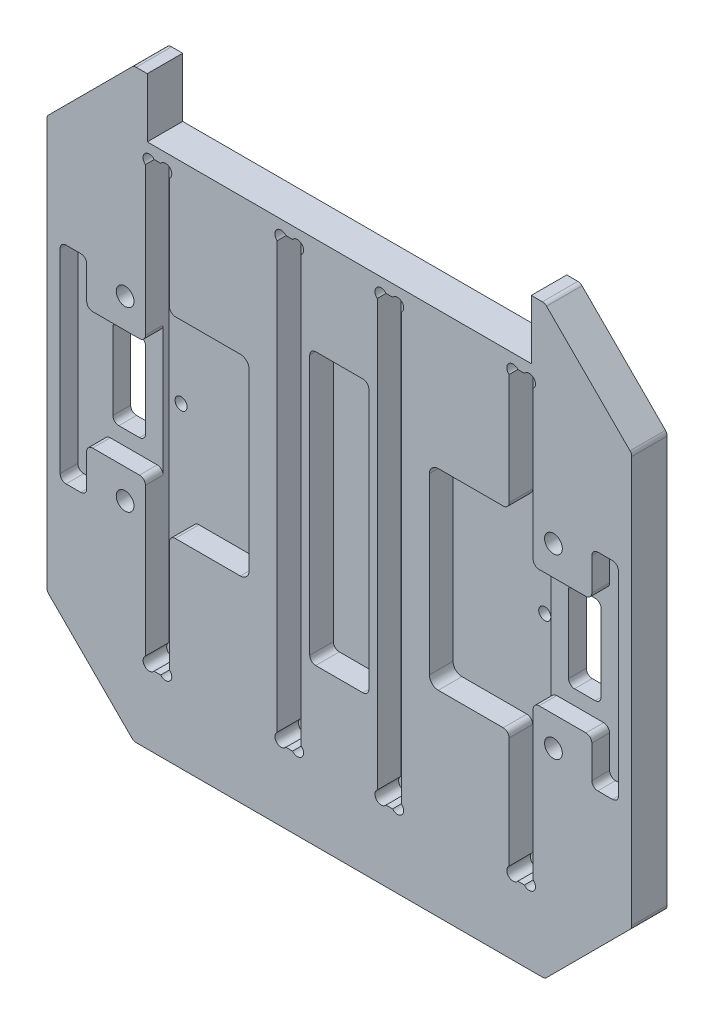
from build123d import *

# Parameters (mm, degrees)
ESQUISSE2_W                   = 200
ESQUISSE2_H                   = 200
BOSS_EXTRU_1_DEPTH            = 12
CHANFREIN1_SIZE               = 30
ENL_V_MAT_EXTRU_1_DEPTH       = 284.097156468
ENL_V_MAT_EXTRU_1_DEPTH_BACK  = 284.097156468
ESQUISSE3_R                   = 3
ENL_V_MAT_EXTRU_2_DEPTH       = 10
ESQUISSE5_W                   = 20
ESQUISSE5_H                   = 40
ENL_V_MAT_EXTRU_3_DEPTH       = 6
ESQUISSE6_W                   = 8.12
ESQUISSE6_H                   = 150
ENL_V_MAT_EXTRU_4_DEPTH       = 8
ESQUISSE7_R                   = 2.1
ENL_V_MAT_EXTRU_5_DEPTH       = 8
ESQUISSE8_W                   = 20
ESQUISSE8_H                   = 92
ENL_V_MAT_EXTRU_6_DEPTH       = 8
ENL_V_START                   = -8
ENL_V_MAT_EXTRU_8_DEPTH       = 8
ENL_V_MAT_EXTRU_9_DEPTH       = 283.906344927
ENL_V_MAT_EXTRU_9_DEPTH_BACK  = 283.906344927
ESQUISSE11_W                  = 11
ESQUISSE11_H                  = 30
CONG_1_R                      = 2
CONG_2_R                      = 2
ENL_V_MAT_EXTRU_7_DEPTH       = 284.097156468
ENL_V_MAT_EXTRU_7_DEPTH_BACK  = 284.097156468
CONG_3_R                      = 2
BOSS_EXTRU_2_DEPTH            = 4
BOSS_EXTRU_3_DEPTH            = 6
ENL_V_MAT_EXTRU_10_DEPTH      = 282.542181564
ENL_V_MAT_EXTRU_10_DEPTH_BACK = 282.542181564
ESQUISSE14_R                  = 2.05
ENL_V_MAT_EXTRU_11_DEPTH      = 282.68422036
ENL_V_MAT_EXTRU_11_DEPTH_BACK = 282.68422036
ESQUISSE15_W                  = 130
ESQUISSE15_H                  = 20


with BuildPart() as part:
    # Esquisse2 → Boss.-Extru.1 (new body)
    with BuildSketch(Plane.XY):
        with Locations((100, 100)):
            Rectangle(ESQUISSE2_W, ESQUISSE2_H)
    extrude(amount=BOSS_EXTRU_1_DEPTH)

    # Chanfrein1
    chanfrein1_edges = [part.edges().sort_by_distance(p)[0] for p in [
        (0, 200, 6),
        (200, 200, 6),
        (200, 0, 6),
        (0, 0, 6),
    ]]
    chamfer(chanfrein1_edges, length=CHANFREIN1_SIZE)

    # Esquisse3 → Enlèv. mat.-Extru.1 (cut, two sides: drawn at the far end of the back side and taken through both)
    with BuildSketch(Plane.XY.offset(12).offset(-ENL_V_MAT_EXTRU_1_DEPTH_BACK)):
        with Locations((172.5, 130)):
            Circle(ESQUISSE3_R)
        with Locations(Location((172.5, 70, 0), (0, 0, 180))):
            Circle(ESQUISSE3_R)
        with Locations((27.5, 70)):
            Circle(ESQUISSE3_R)
        with Locations(Location((27.5, 130, 0), (0, 0, 180))):
            Circle(ESQUISSE3_R)
        with BuildLine():
            Line((185.5, 67), (185.5, 133))
            ThreePointArc((185.5, 133), (186.085786438, 134.414213562), (187.5, 135))
            Line((187.5, 135), (192.5, 135))
            ThreePointArc((192.5, 135), (193.914213562, 134.414213562), (194.5, 133))
            Line((194.5, 133), (194.5, 67))
            ThreePointArc((194.5, 67), (193.914213562, 65.585786438), (192.5, 65))
            Line((192.5, 65), (187.5, 65))
            ThreePointArc((187.5, 65), (186.085786438, 65.585786438), (185.5, 67))
        make_face()
        with BuildLine():
            Line((12.5, 65), (7.5, 65))
            ThreePointArc((7.5, 65), (6.085786438, 65.585786438), (5.5, 67))
            Line((5.5, 67), (5.5, 133))
            ThreePointArc((5.5, 133), (6.085786438, 134.414213562), (7.5, 135))
            Line((7.5, 135), (12.5, 135))
            ThreePointArc((12.5, 135), (13.914213562, 134.414213562), (14.5, 133))
            Line((14.5, 133), (14.5, 67))
            ThreePointArc((14.5, 67), (13.914213562, 65.585786438), (12.5, 65))
        make_face()
        with BuildLine():
            Line((69.5, 70.5), (69.5, 129.5))
            ThreePointArc((69.5, 129.5), (68.621320344, 131.621320344), (66.5, 132.5))
            Line((66.5, 132.5), (45.5, 132.5))
            ThreePointArc((45.5, 132.5), (43.378679656, 131.621320344), (42.5, 129.5))
            Line((42.5, 129.5), (42.5, 70.5))
            ThreePointArc((42.5, 70.5), (43.378679656, 68.378679656), (45.5, 67.5))
            Line((45.5, 67.5), (66.5, 67.5))
            ThreePointArc((66.5, 67.5), (68.621320344, 68.378679656), (69.5, 70.5))
        make_face()
        with BuildLine():
            Line((133.5, 67.5), (154.5, 67.5))
            ThreePointArc((154.5, 67.5), (156.621320344, 68.378679656), (157.5, 70.5))
            Line((157.5, 70.5), (157.5, 129.5))
            ThreePointArc((157.5, 129.5), (156.621320344, 131.621320344), (154.5, 132.5))
            Line((154.5, 132.5), (133.5, 132.5))
            ThreePointArc((133.5, 132.5), (131.378679656, 131.621320344), (130.5, 129.5))
            Line((130.5, 129.5), (130.5, 70.5))
            ThreePointArc((130.5, 70.5), (131.378679656, 68.378679656), (133.5, 67.5))
        make_face()
    extrude(amount=ENL_V_MAT_EXTRU_1_DEPTH + ENL_V_MAT_EXTRU_1_DEPTH_BACK, mode=Mode.SUBTRACT)

    # Esquisse4 → Enlèv. mat.-Extru.2 (cut)
    with BuildSketch(Plane.XY.offset(12)):
        Polygon((170, 200), (30, 200), (0, 170), (0, 30), (30, 0), (170, 0), (200, 30), (200, 170), align=None)
        Polygon((169.585786438, 199), (30.414213562, 199), (1, 169.585786438), (1, 30.414213562), (30.414213562, 1), (169.585786438, 1), (199, 30.414213562), (199, 169.585786438), align=None, mode=Mode.SUBTRACT)
    extrude(amount=-ENL_V_MAT_EXTRU_2_DEPTH, mode=Mode.SUBTRACT)

    # Esquisse5 → Enlèv. mat.-Extru.3 (cut)
    with BuildSketch(Plane.XY.offset(12)):
        with Locations((24.5, 100)):
            Rectangle(ESQUISSE5_W, ESQUISSE5_H)
        with Locations((175.5, 100)):
            Rectangle(ESQUISSE5_W, ESQUISSE5_H)
    extrude(amount=-ENL_V_MAT_EXTRU_3_DEPTH, mode=Mode.SUBTRACT)

    # Esquisse6 → Enlèv. mat.-Extru.4 (cut)
    with BuildSketch(Plane.XY.offset(12)):
        with Locations((161.56, 100)):
            Rectangle(ESQUISSE6_W, ESQUISSE6_H)
        with Locations((38.44, 100)):
            Rectangle(ESQUISSE6_W, ESQUISSE6_H)
        with Locations((116.94, 100)):
            Rectangle(ESQUISSE6_W, ESQUISSE6_H)
        with Locations((83.06, 100)):
            Rectangle(ESQUISSE6_W, ESQUISSE6_H)
    extrude(amount=-ENL_V_MAT_EXTRU_4_DEPTH, mode=Mode.SUBTRACT)

    # Esquisse7 → Enlèv. mat.-Extru.5 (cut)
    with BuildSketch(Plane.XY.offset(12)):
        with Locations((114.18, 173.7)):
            Circle(ESQUISSE7_R)
        with Locations((119.7, 173.7)):
            Circle(ESQUISSE7_R)
        with Locations((119.7, 26.3)):
            Circle(ESQUISSE7_R)
        with Locations((114.18, 26.3)):
            Circle(ESQUISSE7_R)
        with Locations((164.32, 26.3)):
            Circle(ESQUISSE7_R)
        with Locations((158.8, 26.3)):
            Circle(ESQUISSE7_R)
        with Locations((158.8, 173.7)):
            Circle(ESQUISSE7_R)
        with Locations((164.32, 173.7)):
            Circle(ESQUISSE7_R)
        with Locations((35.68, 173.7)):
            Circle(ESQUISSE7_R)
        with Locations((41.2, 173.7)):
            Circle(ESQUISSE7_R)
        with Locations((41.2, 26.3)):
            Circle(ESQUISSE7_R)
        with Locations((35.68, 26.3)):
            Circle(ESQUISSE7_R)
        with Locations((85.82, 26.3)):
            Circle(ESQUISSE7_R)
        with Locations((80.3, 26.3)):
            Circle(ESQUISSE7_R)
        with Locations((80.3, 173.7)):
            Circle(ESQUISSE7_R)
        with Locations((85.82, 173.7)):
            Circle(ESQUISSE7_R)
    extrude(amount=-ENL_V_MAT_EXTRU_5_DEPTH, mode=Mode.SUBTRACT)

    # Esquisse8 → Enlèv. mat.-Extru.6 (cut)
    with BuildSketch(Plane.XY.offset(12)):
        with Locations((100, 100)):
            Rectangle(ESQUISSE8_W, ESQUISSE8_H)
    extrude(amount=-ENL_V_MAT_EXTRU_6_DEPTH, mode=Mode.SUBTRACT)

    # Esquisse10 → Enlèv. mat.-Extru.8 (cut)
    with BuildSketch(Plane.XY.offset(12).offset(ENL_V_START)):
        Polygon((45.5, 132.5), (42.5, 132.5), (42.5, 129.5), align=None)
        Polygon((42.5, 70.5), (45.5, 67.5), (42.5, 67.5), align=None)
        Polygon((154.5, 67.5), (157.5, 67.5), (157.5, 70.5), align=None)
        Polygon((157.5, 129.5), (154.5, 132.5), (157.5, 132.5), align=None)
    extrude(amount=ENL_V_MAT_EXTRU_8_DEPTH, mode=Mode.SUBTRACT)

    # Esquisse11 → Enlèv. mat.-Extru.9 (cut, two sides: drawn at the far end of the back side and taken through both)
    with BuildSketch(Plane.XY.offset(6).offset(-ENL_V_MAT_EXTRU_9_DEPTH_BACK)):
        with Locations((22.88, 100)):
            Rectangle(ESQUISSE11_W, ESQUISSE11_H)
        with Locations((177.12, 100)):
            Rectangle(ESQUISSE11_W, ESQUISSE11_H)
    extrude(amount=ENL_V_MAT_EXTRU_9_DEPTH + ENL_V_MAT_EXTRU_9_DEPTH_BACK, mode=Mode.SUBTRACT)

    # Congé1
    cong_1_edges = [part.edges().sort_by_distance(p)[0] for p in [
        (185.5, 120, 9),
        (185.5, 80, 9),
        (14.5, 120, 9),
        (14.5, 80, 9),
        (165.62, 120, 9),
        (165.62, 80, 9),
        (34.38, 120, 9),
        (34.38, 80, 9),
        (90, 146, 8),
        (110, 146, 8),
        (110, 54, 8),
        (90, 54, 8),
        (42.5, 132.5, 8),
        (42.5, 67.5, 8),
        (157.5, 67.5, 8),
        (157.5, 132.5, 8),
    ]]
    fillet(cong_1_edges, radius=CONG_1_R)

    # Congé2
    cong_2_edges = [part.edges().sort_by_distance(p)[0] for p in [
        (0, 30, 1),
        (30, 200, 1),
        (30, 0, 1),
        (200, 30, 1),
        (170, 200, 1),
        (0, 170, 1),
        (199, 169.585786438, 7),
        (199, 30.414213562, 7),
        (169.585786438, 1, 7),
        (30.414213562, 1, 7),
        (1, 30.414213562, 7),
        (1, 169.585786438, 7),
        (30.414213562, 199, 7),
        (169.585786438, 199, 7),
        (200, 170, 1),
        (170, 0, 1),
    ]]
    fillet(cong_2_edges, radius=CONG_2_R)

    # Esquisse9 → Enlèv. mat.-Extru.7 (cut, two sides: drawn at the far end of the back side and taken through both)
    with BuildSketch(Plane.XY.offset(12).offset(-ENL_V_MAT_EXTRU_7_DEPTH_BACK)):
        with BuildLine():
            Line((22.757359313, 205.485281374), (-5.485281374, 177.242640687))
            ThreePointArc((-5.485281374, 177.242640687), (-8.08655439, 173.349560501), (-9, 168.757359313))
            Line((-9, 168.757359313), (-9, 31.242640687))
            ThreePointArc((-9, 31.242640687), (-8.08655439, 26.650439499), (-5.485281374, 22.757359313))
            Line((-5.485281374, 22.757359313), (22.757359313, -5.485281374))
            ThreePointArc((22.757359313, -5.485281374), (26.650439499, -8.08655439), (31.242640687, -9))
            Line((31.242640687, -9), (168.757359313, -9))
            ThreePointArc((168.757359313, -9), (173.349560501, -8.08655439), (177.242640687, -5.485281374))
            Line((177.242640687, -5.485281374), (205.485281374, 22.757359313))
            ThreePointArc((205.485281374, 22.757359313), (208.08655439, 26.650439499), (209, 31.242640687))
            Line((209, 31.242640687), (209, 168.757359313))
            ThreePointArc((209, 168.757359313), (208.08655439, 173.349560501), (205.485281374, 177.242640687))
            Line((205.485281374, 177.242640687), (177.242640687, 205.485281374))
            ThreePointArc((177.242640687, 205.485281374), (173.349560501, 208.08655439), (168.757359313, 209))
            Line((168.757359313, 209), (31.242640687, 209))
            ThreePointArc((31.242640687, 209), (26.650439499, 208.08655439), (22.757359313, 205.485281374))
        make_face()
        with BuildLine():
            Line((29.828427125, 198.414213562), (1.585786438, 170.171572875))
            ThreePointArc((1.585786438, 170.171572875), (1.152240935, 169.522726178), (1, 168.757359313))
            Line((1, 168.757359313), (1, 31.242640687))
            ThreePointArc((1, 31.242640687), (1.152240935, 30.477273822), (1.585786438, 29.828427125))
            Line((1.585786438, 29.828427125), (29.828427125, 1.585786438))
            ThreePointArc((29.828427125, 1.585786438), (30.477273822, 1.152240935), (31.242640687, 1))
            Line((31.242640687, 1), (168.757359313, 1))
            ThreePointArc((168.757359313, 1), (169.522726178, 1.152240935), (170.171572875, 1.585786438))
            Line((170.171572875, 1.585786438), (198.414213562, 29.828427125))
            ThreePointArc((198.414213562, 29.828427125), (198.847759065, 30.477273822), (199, 31.242640687))
            Line((199, 31.242640687), (199, 168.757359313))
            ThreePointArc((199, 168.757359313), (198.847759065, 169.522726178), (198.414213562, 170.171572875))
            Line((198.414213562, 170.171572875), (170.171572875, 198.414213562))
            ThreePointArc((170.171572875, 198.414213562), (169.522726178, 198.847759065), (168.757359313, 199))
            Line((168.757359313, 199), (31.242640687, 199))
            ThreePointArc((31.242640687, 199), (30.477273822, 198.847759065), (29.828427125, 198.414213562))
        make_face(mode=Mode.SUBTRACT)
    extrude(amount=ENL_V_MAT_EXTRU_7_DEPTH + ENL_V_MAT_EXTRU_7_DEPTH_BACK, mode=Mode.SUBTRACT)

    # Congé3
    cong_3_edges = [part.edges().sort_by_distance(p)[0] for p in [
        (17.38, 85, 3),
        (17.38, 115, 3),
        (28.38, 115, 3),
        (28.38, 85, 3),
        (171.62, 115, 3),
        (182.62, 115, 3),
        (182.62, 85, 3),
        (171.62, 85, 3),
    ]]
    fillet(cong_3_edges, radius=CONG_3_R)

    # Esquisse12 → Boss.-Extru.2 (add)
    with BuildSketch(Plane(origin=(0, 0, 0), x_dir=(-1, 0, 0), z_dir=(0, 0, -1))):
        with BuildLine():
            Line((-69.5, 70.5), (-69.5, 129.5))
            ThreePointArc((-69.5, 129.5), (-68.621320344, 131.621320344), (-66.5, 132.5))
            Line((-66.5, 132.5), (-45.5, 132.5))
            ThreePointArc((-45.5, 132.5), (-43.378679656, 131.621320344), (-42.5, 129.5))
            Line((-42.5, 129.5), (-42.5, 70.5))
            ThreePointArc((-42.5, 70.5), (-43.378679656, 68.378679656), (-45.5, 67.5))
            Line((-45.5, 67.5), (-66.5, 67.5))
            ThreePointArc((-66.5, 67.5), (-68.621320344, 68.378679656), (-69.5, 70.5))
        make_face()
        with BuildLine():
            Line((-133.5, 67.5), (-154.5, 67.5))
            ThreePointArc((-154.5, 67.5), (-156.621320344, 68.378679656), (-157.5, 70.5))
            Line((-157.5, 70.5), (-157.5, 129.5))
            ThreePointArc((-157.5, 129.5), (-156.621320344, 131.621320344), (-154.5, 132.5))
            Line((-154.5, 132.5), (-133.5, 132.5))
            ThreePointArc((-133.5, 132.5), (-131.378679656, 131.621320344), (-130.5, 129.5))
            Line((-130.5, 129.5), (-130.5, 70.5))
            ThreePointArc((-130.5, 70.5), (-131.378679656, 68.378679656), (-133.5, 67.5))
        make_face()
    extrude(amount=-BOSS_EXTRU_2_DEPTH)

    # Esquisse13 → Boss.-Extru.3 (add)
    with BuildSketch(Plane(origin=(0, 0, 0), x_dir=(-1, 0, 0), z_dir=(0, 0, -1))):
        with BuildLine():
            Line((-14.5, 67), (-14.5, 133))
            ThreePointArc((-14.5, 133), (-13.914213562, 134.414213562), (-12.5, 135))
            Line((-12.5, 135), (-7.5, 135))
            ThreePointArc((-7.5, 135), (-6.085786438, 134.414213562), (-5.5, 133))
            Line((-5.5, 133), (-5.5, 67))
            ThreePointArc((-5.5, 67), (-6.085786438, 65.585786438), (-7.5, 65))
            Line((-7.5, 65), (-12.5, 65))
            ThreePointArc((-12.5, 65), (-13.914213562, 65.585786438), (-14.5, 67))
        make_face()
        with BuildLine():
            Line((-187.5, 65), (-192.5, 65))
            ThreePointArc((-192.5, 65), (-193.914213562, 65.585786438), (-194.5, 67))
            Line((-194.5, 67), (-194.5, 133))
            ThreePointArc((-194.5, 133), (-193.914213562, 134.414213562), (-192.5, 135))
            Line((-192.5, 135), (-187.5, 135))
            ThreePointArc((-187.5, 135), (-186.085786438, 134.414213562), (-185.5, 133))
            Line((-185.5, 133), (-185.5, 67))
            ThreePointArc((-185.5, 67), (-186.085786438, 65.585786438), (-187.5, 65))
        make_face()
    extrude(amount=-BOSS_EXTRU_3_DEPTH)

    # Esquisse14 → Enlèv. mat.-Extru.10 (cut, two sides: drawn at the far end of the back side and taken through both)
    with BuildSketch(Plane.XY.offset(4).offset(-ENL_V_MAT_EXTRU_10_DEPTH_BACK)):
        with Locations((83.06, 160)):
            Circle(ESQUISSE14_R)
        with Locations((83.06, 40)):
            Circle(ESQUISSE14_R)
        with Locations((83.06, 100)):
            Circle(ESQUISSE14_R)
        with Locations((38.44, 100)):
            Circle(ESQUISSE14_R)
        with Locations((38.44, 40)):
            Circle(ESQUISSE14_R)
        with Locations((38.44, 160)):
            Circle(ESQUISSE14_R)
        with Locations((161.56, 160)):
            Circle(ESQUISSE14_R)
        with Locations((161.56, 40)):
            Circle(ESQUISSE14_R)
        with Locations((161.56, 100)):
            Circle(ESQUISSE14_R)
        with Locations((116.94, 100)):
            Circle(ESQUISSE14_R)
        with Locations((116.94, 40)):
            Circle(ESQUISSE14_R)
        with Locations((116.94, 160)):
            Circle(ESQUISSE14_R)
    extrude(amount=ENL_V_MAT_EXTRU_10_DEPTH + ENL_V_MAT_EXTRU_10_DEPTH_BACK, mode=Mode.SUBTRACT)

    # Esquisse15 → Enlèv. mat.-Extru.11 (cut, two sides: drawn at the far end of the back side and taken through both)
    with BuildSketch(Plane.XY.offset(12).offset(-ENL_V_MAT_EXTRU_11_DEPTH_BACK)):
        with Locations((100, 189)):
            Rectangle(ESQUISSE15_W, ESQUISSE15_H)
    extrude(amount=ENL_V_MAT_EXTRU_11_DEPTH + ENL_V_MAT_EXTRU_11_DEPTH_BACK, mode=Mode.SUBTRACT)


solid = part.part
